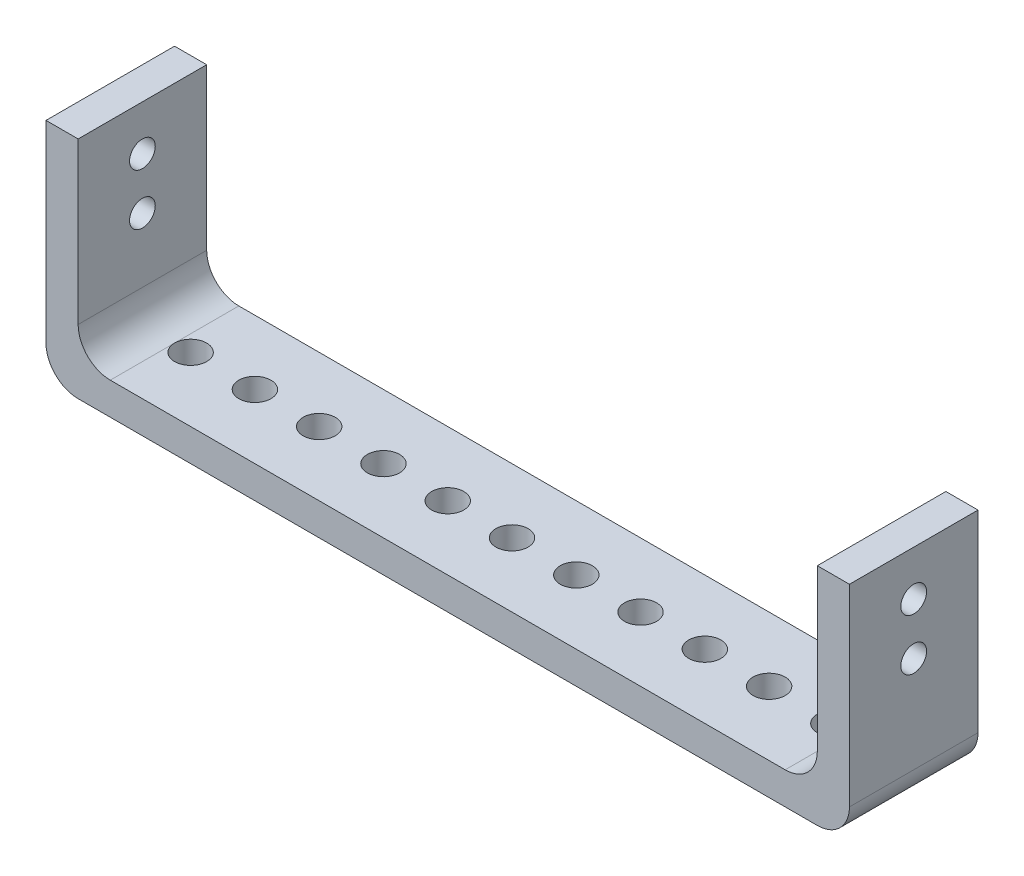
from build123d import *

# Parameters (mm, degrees)
BOSS_EXTRUDE1_DEPTH     = 10
SKETCH2_R               = 2
CUT_EXTRUDE1_DEPTH      = 131.192165663
LPATTERN2_COUNT         = 2
LPATTERN2_PITCH         = 8
CUT_EXTRUDE2_DEPTH      = 73.327380707
CUT_EXTRUDE2_DEPTH_BACK = 73.327380707
SKETCH3_R               = 2.5


with BuildPart() as part:
    # Sketch1 → Boss-Extrude1 (new, symmetric)
    with BuildSketch(Plane.XY):
        with BuildLine():
            Line((-57.5, 0), (57.5, 0))
            ThreePointArc((57.5, 0), (61.035533906, 1.464466094), (62.5, 5))
            Line((62.5, 5), (62.5, 35))
            Line((62.5, 35), (57.5, 35))
            Line((57.5, 35), (57.5, 10))
            ThreePointArc((57.5, 10), (56.035533906, 6.464466094), (52.5, 5))
            Line((52.5, 5), (-52.5, 5))
            ThreePointArc((-52.5, 5), (-56.035533906, 6.464466094), (-57.5, 10))
            Line((-57.5, 10), (-57.5, 35))
            Line((-57.5, 35), (-62.5, 35))
            Line((-62.5, 35), (-62.5, 5))
            ThreePointArc((-62.5, 5), (-61.035533906, 1.464466094), (-57.5, 0))
        make_face()
    extrude(amount=BOSS_EXTRUDE1_DEPTH, both=True)

    # Sketch2 → Cut-Extrude1 (cut, symmetric)
    with BuildSketch(Plane(origin=(62.5, 0, 0), x_dir=(0, 0, -1), z_dir=(1, 0, 0))):
        with Locations((0, 20)):
            Circle(SKETCH2_R)
    cut_extrude1 = extrude(amount=CUT_EXTRUDE1_DEPTH, both=True, mode=Mode.SUBTRACT)

    # LPattern2: Cut-Extrude1 ×2
    with Locations(*[(0, i * LPATTERN2_PITCH, 0) for i in range(1, LPATTERN2_COUNT)]):
        add(cut_extrude1, mode=Mode.SUBTRACT)

    # Sketch3 → Cut-Extrude2 (cut, two sides: drawn at the far end of the back side and taken through both)
    with BuildSketch(Plane.XZ.offset(-CUT_EXTRUDE2_DEPTH_BACK)):
        Circle(SKETCH3_R)
        with Locations((-10, 0)):
            Circle(SKETCH3_R)
        with Locations((-20, 0)):
            Circle(SKETCH3_R)
        with Locations((-30, 0)):
            Circle(SKETCH3_R)
        with Locations((-40, 0)):
            Circle(SKETCH3_R)
        with Locations(Location((-50, 0, 0), (0, 0, 180))):
            Circle(SKETCH3_R)
        with Locations((10, 0)):
            Circle(SKETCH3_R)
        with Locations((20, 0)):
            Circle(SKETCH3_R)
        with Locations((30, 0)):
            Circle(SKETCH3_R)
        with Locations((40, 0)):
            Circle(SKETCH3_R)
        with Locations((50, 0)):
            Circle(SKETCH3_R)
    extrude(amount=CUT_EXTRUDE2_DEPTH + CUT_EXTRUDE2_DEPTH_BACK, mode=Mode.SUBTRACT)


solid = part.part
